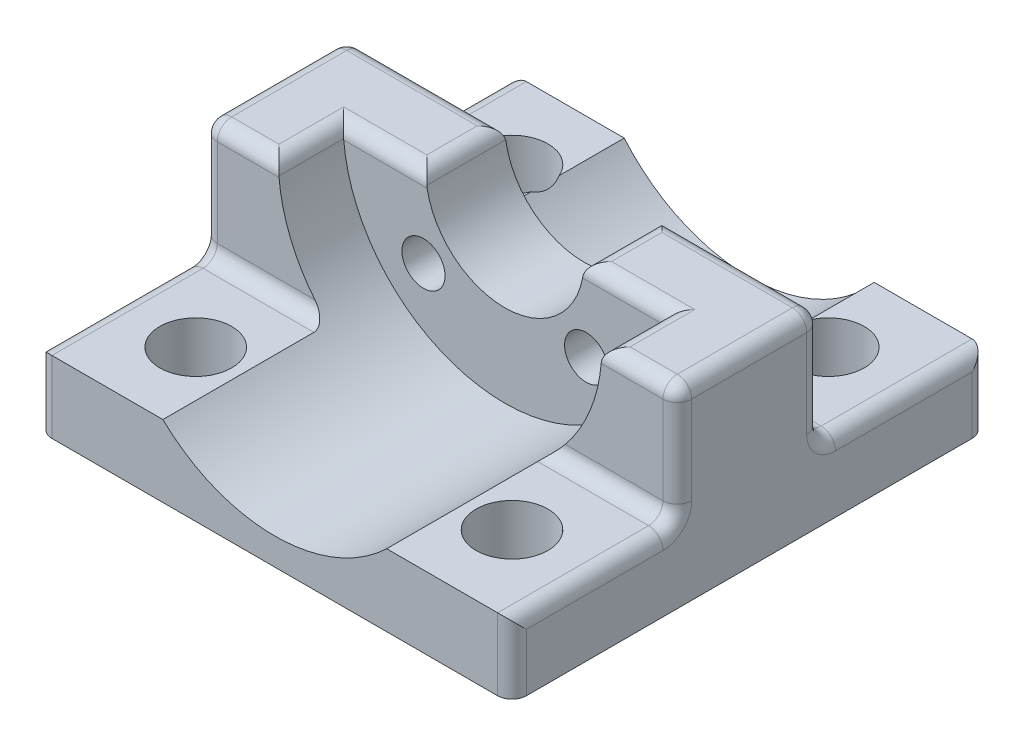
from build123d import *

# Parameters (mm, degrees)
BOSS_EXTRUDE1_DEPTH = 10
SKETCH6_W           = 33
SKETCH6_H           = 33
SKETCH6_R           = 2.5
BOSS_EXTRUDE2_DEPTH = 5
SKETCH4_R           = 11.25
CUT_EXTRUDE1_DEPTH  = 16
CUT_EXTRUDE2_REACH  = 29.083
SKETCH5_R           = 1.5
CUT_EXTRUDE3_REACH  = 32.112
SKETCH7_R           = 11.399645817
FILLET1_R           = 1


with BuildPart() as part:
    # Sketch3 → Boss-Extrude1 (new body)
    with BuildSketch(Plane.XY):
        with BuildLine():
            Line((-16.5, 0), (16.5, 0))
            Line((16.5, 0), (16.5, 13.123))
            Line((16.5, 13.123), (11.5, 13.123))
            Line((11.5, 13.123), (5.5, 13.123))
            ThreePointArc((5.5, 13.123), (0, 7.623), (-5.5, 13.123))
            Line((-5.5, 13.123), (-11.5, 13.123))
            Line((-11.5, 13.123), (-16.5, 13.123))
            Line((-16.5, 13.123), (-16.5, 0))
        make_face()
    extrude(amount=BOSS_EXTRUDE1_DEPTH)

    # Sketch6 → Boss-Extrude2 (add)
    with BuildSketch(Plane(origin=(0, 0, 0), x_dir=(-1, 0, 0), z_dir=(0, -1, 0))):
        with Locations((0, -5)):
            Rectangle(SKETCH6_W, SKETCH6_H)
        with Locations(Location((11, -16, 0), (0, 0, 180))):
            Circle(SKETCH6_R, mode=Mode.SUBTRACT)
        with Locations(Location((-11, -16, 0), (0, 0, 180))):
            Circle(SKETCH6_R, mode=Mode.SUBTRACT)
        with Locations(Location((-11, 6, 0), (0, 0, 180))):
            Circle(SKETCH6_R, mode=Mode.SUBTRACT)
        with Locations(Location((11, 6, 0), (0, 0, 180))):
            Circle(SKETCH6_R, mode=Mode.SUBTRACT)
    extrude(amount=-BOSS_EXTRUDE2_DEPTH)

    # Sketch4 → Cut-Extrude1 (cut)
    with BuildSketch(Plane.XY.offset(21.5)):
        with Locations((0, 13.123)):
            Circle(SKETCH4_R)
    extrude(amount=-CUT_EXTRUDE1_DEPTH, mode=Mode.SUBTRACT)

    # Sketch5 → Cut-Extrude2 (cut, up to next)
    with BuildSketch(Plane.XY.offset(5.5), mode=Mode.PRIVATE) as cut_extrude2_sk1:
        with Locations((-5.656854249, 7.466145751)):
            Circle(SKETCH5_R)
    cut_extrude2_tool1 = extrude(cut_extrude2_sk1.sketch, amount=-CUT_EXTRUDE2_REACH, mode=Mode.PRIVATE) & part.part
    # Sketch5 → Cut-Extrude2 (cut, up to next)
    with BuildSketch(Plane.XY.offset(5.5), mode=Mode.PRIVATE) as cut_extrude2_sk2:
        with Locations((5.656854249, 7.466145751)):
            Circle(SKETCH5_R)
    cut_extrude2_tool2 = extrude(cut_extrude2_sk2.sketch, amount=-CUT_EXTRUDE2_REACH, mode=Mode.PRIVATE) & part.part
    add(cut_extrude2_tool1.solids().sort_by_distance((-5.656854, 7.466146, 5.5))[0], mode=Mode.SUBTRACT)
    add(cut_extrude2_tool2.solids().sort_by_distance((5.656854, 7.466146, 5.5))[0], mode=Mode.SUBTRACT)

    # Sketch7 → Cut-Extrude3 (cut, up to next)
    with BuildSketch(Plane(origin=(0, 0, 0), x_dir=(-1, 0, 0), z_dir=(0, 0, -1)), mode=Mode.PRIVATE) as cut_extrude3_sk1:
        with Locations((0, 12.372645817)):
            Circle(SKETCH7_R)
    cut_extrude3_tool1 = extrude(cut_extrude3_sk1.sketch, amount=CUT_EXTRUDE3_REACH, mode=Mode.PRIVATE) & part.part
    add(cut_extrude3_tool1.solids().sort_by_distance((0, 12.372646, 0))[0], mode=Mode.SUBTRACT)

    # Fillet1
    fillet1_edges = [part.edges().sort_by_distance(p)[0] for p in [
        (16.5, 13.123, 5),
        (-16.5, 13.123, 5),
        (16.5, 9.0615, 0),
        (-16.5, 9.0615, 0),
        (-12.597298541, 5, 0),
        (-16.5, 9.0615, 10),
        (16.5, 9.0615, 10),
        (-16.5, 5, -5.75),
        (-16.5, 2.5, -11.5),
        (16.5, 5, -5.75),
        (-12.141637541, 5, 10),
        (13.875, 13.123, 10),
        (-16.5, 5, 15.75),
        (-16.5, 2.5, 21.5),
        (16.5, 5, 15.75),
        (16.5, 2.5, 21.5),
        (16.5, 2.5, -11.5),
        (12.141637541, 5, 10),
        (5.5, 13.123, 2.75),
        (8.375, 13.123, 5.5),
        (-5.5, 13.123, 2.75),
        (11.25, 13.123, 7.75),
        (-11.25, 13.123, 7.75),
        (-8.375, 13.123, 5.5),
        (11, 13.123, 0),
        (12.597298541, 5, 0),
        (-13.875, 13.123, 10),
        (-11, 13.123, 0),
    ]]
    fillet(fillet1_edges, radius=FILLET1_R)


solid = part.part
